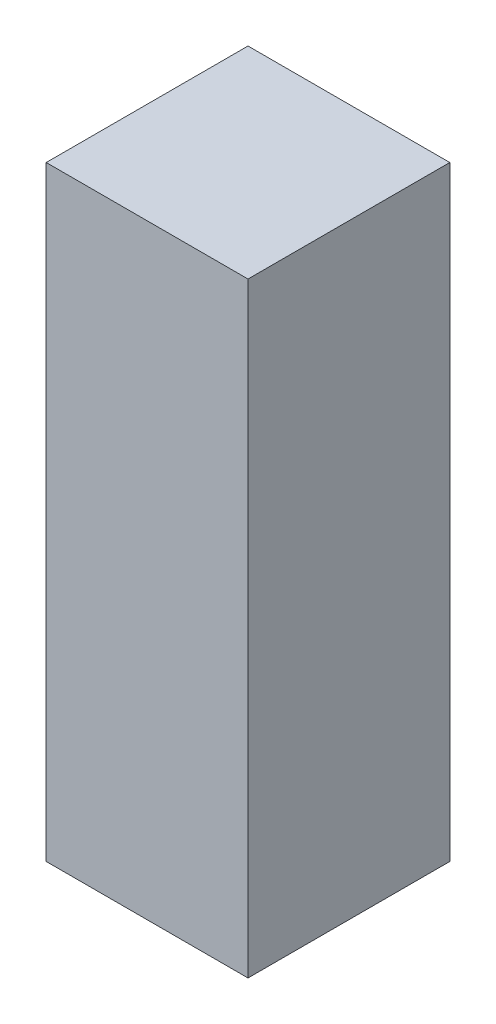
from build123d import *

# Parameters (mm, degrees)
SKETCH1_W           = 101.6
SKETCH1_H           = 101.6
BOSS_EXTRUDE1_DEPTH = 304.8


with BuildPart() as part:
    # Sketch1 → Boss-Extrude1 (new body)
    with BuildSketch(Plane(origin=(0, 0, 0), x_dir=(1, 0, 0), z_dir=(0, 1, 0))):
        Rectangle(SKETCH1_W, SKETCH1_H)
    extrude(amount=BOSS_EXTRUDE1_DEPTH)


solid = part.part
